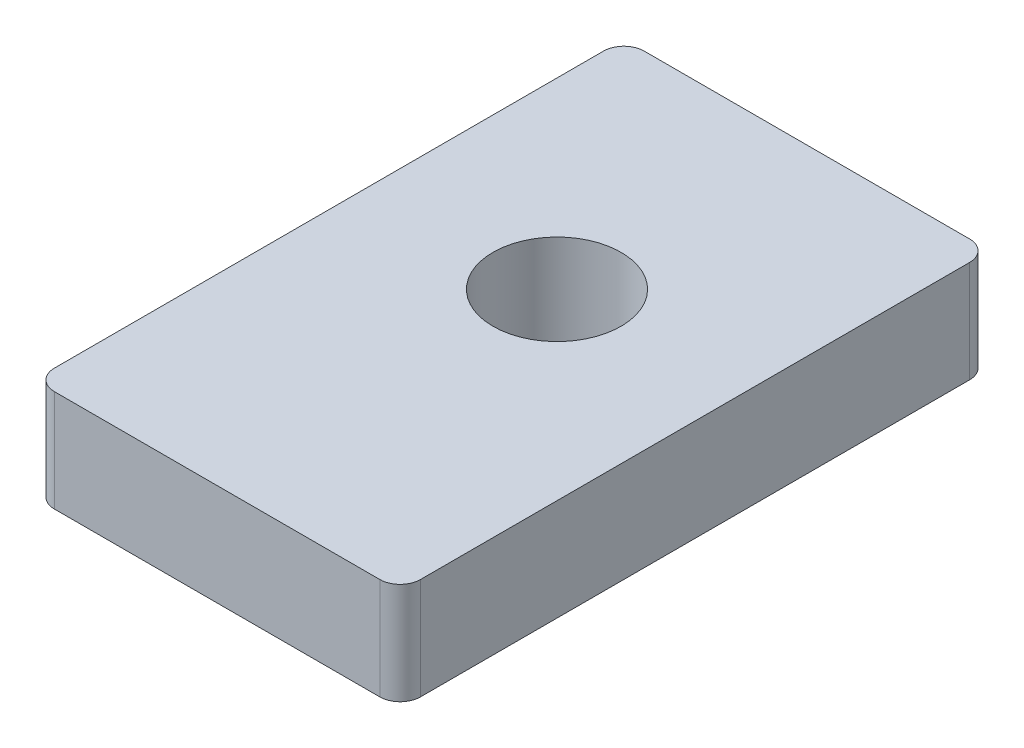
from build123d import *

# Parameters (mm, degrees)
SKETCH_1_W                = 36
SKETCH_1_H                = 10
BLOCKEXTRUDE_DEPTH        = 58
FILLET_2_R                = 2
SKETCH_2_R                = 6.3
DRIVE_SHAFT_PASSAGE_DEPTH = 69.992753243


with BuildPart() as part:
    # 草图1 → BlockExtrude (new body)
    with BuildSketch(Plane.XY):
        with Locations((18, 5)):
            Rectangle(SKETCH_1_W, SKETCH_1_H)
    extrude(amount=BLOCKEXTRUDE_DEPTH)

    # Fillet 2
    fillet_2_edges = [part.edges().sort_by_distance(p)[0] for p in [
        (36, 5, 58),
        (0, 5, 58),
        (36, 5, 0),
        (0, 5, 0),
    ]]
    fillet(fillet_2_edges, radius=FILLET_2_R)

    # 草图2 → Drive_shaft_passage (cut, through all)
    with BuildSketch(Plane(origin=(0, 10, 0), x_dir=(1, 0, 0), z_dir=(0, 1, 0))):
        with Locations(Location((18, -24.5744, 0), (0, 0, 270))):
            Circle(SKETCH_2_R)
    extrude(amount=-DRIVE_SHAFT_PASSAGE_DEPTH, mode=Mode.SUBTRACT)


solid = part.part
